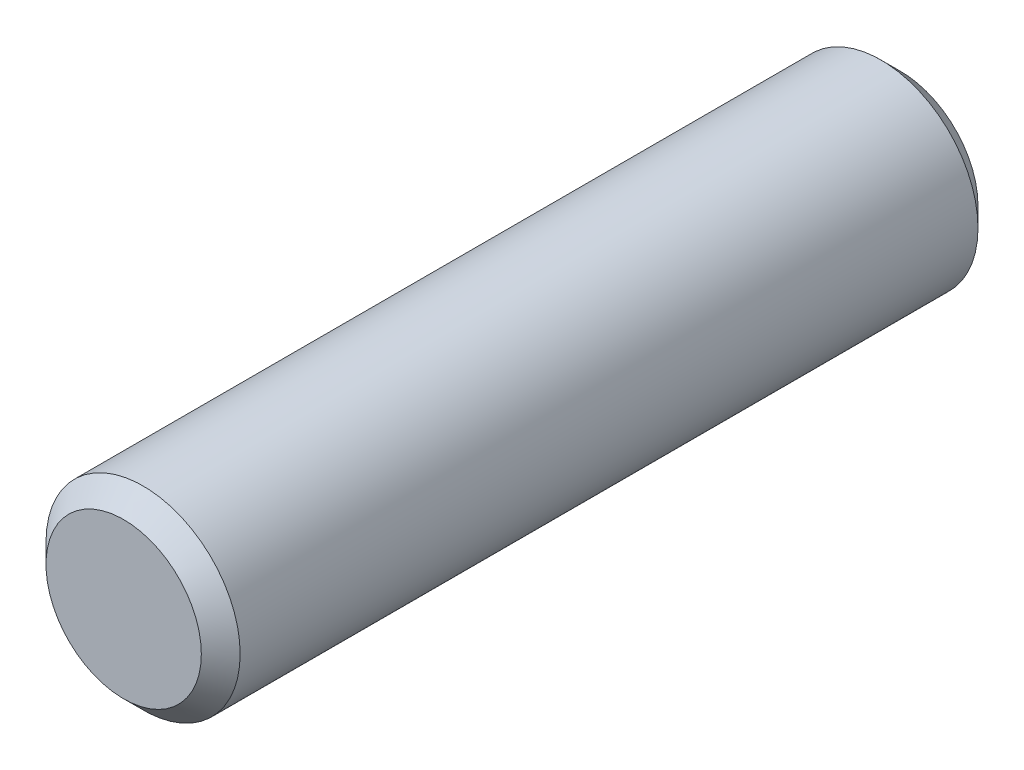
from build123d import *

# Parameters (mm, degrees)
SKETCH_1_R      = 3.5
EXTRUDE_1_DEPTH = 14
CHAMFER_1_SIZE  = 0.7


with BuildPart() as part:
    # 스케치1 → 보스-돌출1 (new, symmetric)
    with BuildSketch(Plane.XY):
        Circle(SKETCH_1_R)
    extrude(amount=EXTRUDE_1_DEPTH, both=True)

    # 모따기1
    chamfer_1_edges = [part.edges().sort_by_distance(p)[0] for p in [
        (-3.5, 0, -14),
        (-3.5, 0, 14),
    ]]
    chamfer(chamfer_1_edges, length=CHAMFER_1_SIZE)


solid = part.part
